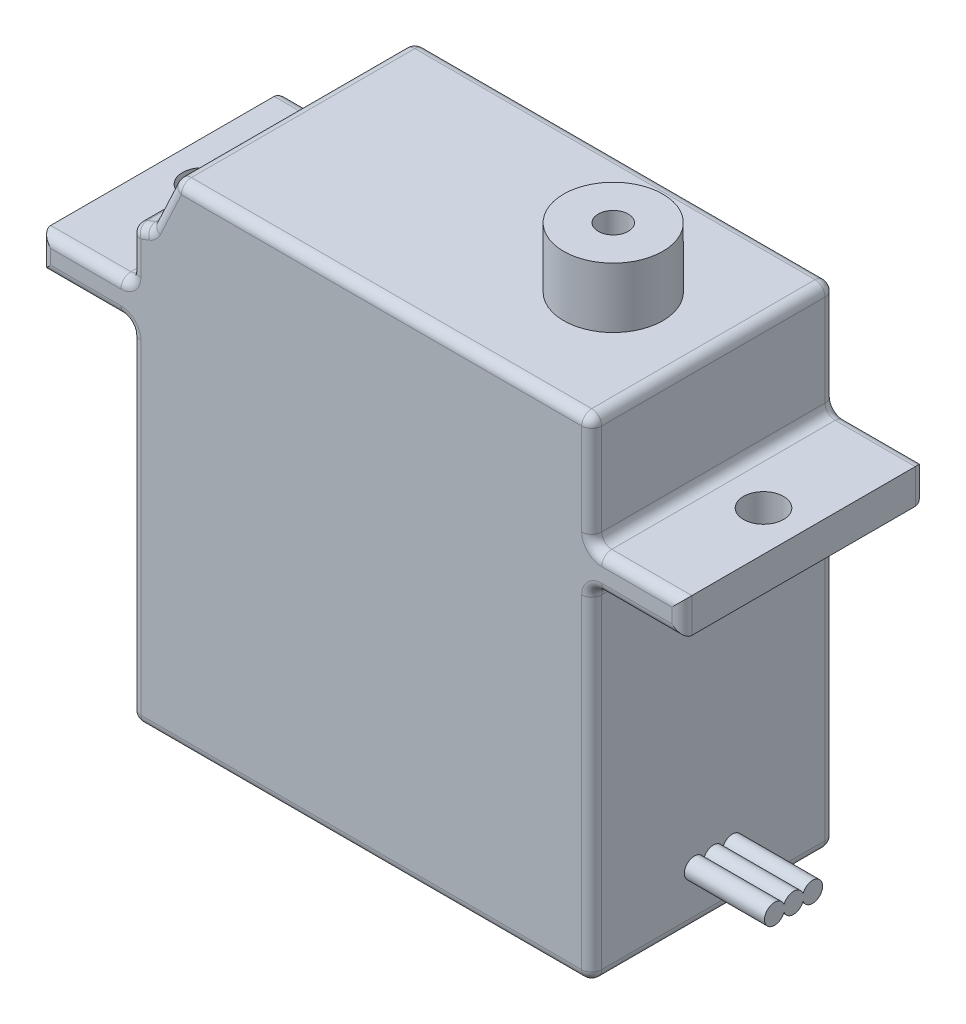
from build123d import *

# Parameters (mm, degrees)
BOSS_EXTRU_1_DEPTH      = 12.15
ESQUISSE2_R             = 1
ENL_V_MAT_EXTRU_1_DEPTH = 28.596900188
ESQUISSE4_R             = 0.5
BOSS_EXTRU_4_DEPTH      = 4
ESQUISSE5_R             = 2.475
ESQUISSE5_R_2           = 0.75
BOSS_EXTRU_5_DEPTH      = 3
CONG_1_R                = 0.5


with BuildPart() as part:
    # Esquisse1 → Boss.-Extru.1 (new body)
    with BuildSketch(Plane.XY):
        Polygon((11.5, -17.2), (-11.5, -17.2), (-11.5, 0), (-16, 0), (-16, 1.72), (-11.5, 1.72), (-11.5, 4.22), (-10.567959043, 4.582352941), (-9.297370807, 7.3), (11.5, 7.3), (11.5, 1.72), (16, 1.72), (16, 0), (11.5, 0), align=None)
    extrude(amount=BOSS_EXTRU_1_DEPTH)

    # Esquisse2 → Enlèv. mat.-Extru.1 (cut, through all)
    with BuildSketch(Plane(origin=(0, 1.72, 0), x_dir=(1, 0, 0), z_dir=(0, 1, 0))):
        with Locations(Location((-14, -6.075, 0), (0, 0, 180))):
            Circle(ESQUISSE2_R)
        with Locations(Location((14, -6.075, 0), (0, 0, 180))):
            Circle(ESQUISSE2_R)
    extrude(amount=-ENL_V_MAT_EXTRU_1_DEPTH, mode=Mode.SUBTRACT)

    # Esquisse4 → Boss.-Extru.4 (add)
    with BuildSketch(Plane(origin=(11.5, 0, 0), x_dir=(0, 0, -1), z_dir=(1, 0, 0))):
        with Locations((-6.075, -14.6)):
            Circle(ESQUISSE4_R)
        with Locations((-7.025, -14.6)):
            Circle(ESQUISSE4_R)
        with Locations((-5.125, -14.6)):
            Circle(ESQUISSE4_R)
    extrude(amount=BOSS_EXTRU_4_DEPTH)

    # Esquisse5 → Boss.-Extru.5 (add)
    with BuildSketch(Plane(origin=(0, 7.3, 0), x_dir=(1, 0, 0), z_dir=(0, 1, 0))):
        with Locations((6.5, -6.075)):
            Circle(ESQUISSE5_R)
        with Locations(Location((6.5, -6.075, 0), (0, 0, 180))):
            Circle(ESQUISSE5_R_2, mode=Mode.SUBTRACT)
    extrude(amount=BOSS_EXTRU_5_DEPTH)

    # Congé1
    cong_1_edges = [part.edges().sort_by_distance(p)[0] for p in [
        (16, 0.86, 12.15),
        (0, -17.2, 0),
        (-11.5, -8.6, 0),
        (13.75, 1.72, 12.15),
        (-13.75, 0, 0),
        (-16, 0.86, 0),
        (-13.75, 1.72, 0),
        (-11.5, 2.97, 0),
        (-11.033979521, 4.401176471, 0),
        (-9.932664925, 5.941176471, 0),
        (1.101314596, 7.3, 0),
        (11.5, 4.51, 12.15),
        (11.5, 4.51, 0),
        (13.75, 1.72, 0),
        (16, 0.86, 0),
        (13.75, 0, 0),
        (11.5, -8.6, 0),
        (1.101314596, 7.3, 12.15),
        (-9.932664925, 5.941176471, 12.15),
        (11.5, -17.2, 6.075),
        (-11.5, -17.2, 6.075),
        (-11.5, 0, 6.075),
        (-11.5, 1.72, 6.075),
        (-11.5, 4.22, 6.075),
        (-10.567959043, 4.582352941, 6.075),
        (-9.297370807, 7.3, 6.075),
        (11.5, 7.3, 6.075),
        (11.5, 1.72, 6.075),
        (11.5, 0, 6.075),
        (-11.033979521, 4.401176471, 12.15),
        (-11.5, 2.97, 12.15),
        (-13.75, 1.72, 12.15),
        (-16, 0.86, 12.15),
        (-13.75, 0, 12.15),
        (11.5, -8.6, 12.15),
        (-11.5, -8.6, 12.15),
        (0, -17.2, 12.15),
        (13.75, 0, 12.15),
    ]]
    fillet(cong_1_edges, radius=CONG_1_R)


solid = part.part
